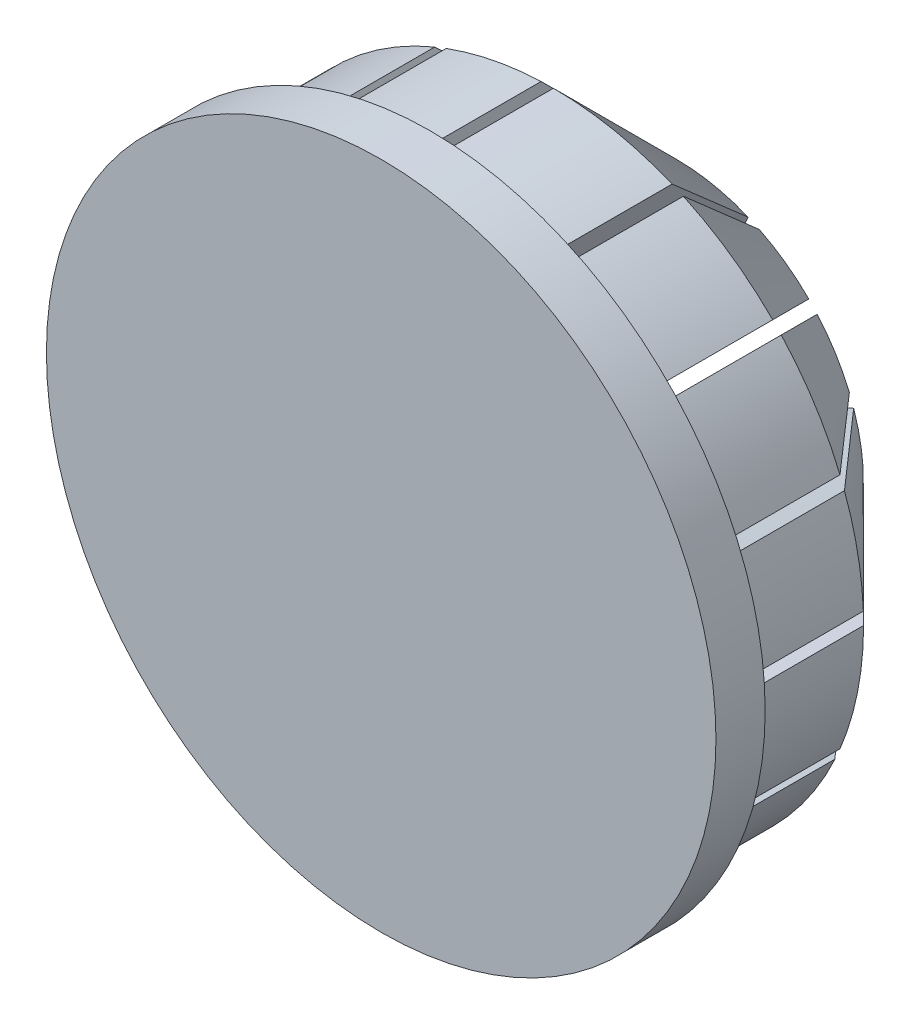
from build123d import *

# Parameters (mm, degrees)
SKETCH1_R            = 40
BOSS_EXTRUDE10_DEPTH = 2
BOSS_EXTRUDE12_START = -2
SKETCH4_R            = 37
BOSS_EXTRUDE12_DEPTH = 2
BOSS_EXTRUDE14_DEPTH = 20
BOSS_EXTRUDE15_DEPTH = 15
BOSS_EXTRUDE16_DEPTH = 10
CHAMFER6_SIZE        = 5
CHAMFER7_SIZE        = 5
CHAMFER8_SIZE        = 5
CHAMFER9_SIZE        = 1
SKETCH5_R            = 42.605372115
SKETCH5_R_2          = 13.605372115
CUT_EXTRUDE1_DEPTH   = 31


with BuildPart() as part:
    # Sketch1 → Boss-Extrude10 (new body)
    with BuildSketch(Plane.XY):
        Circle(SKETCH1_R)
        with BuildLine():
            ThreePointArc((-0.5, 36.996621467), (-0.250005707, 36.999155357), (0, 37))
            ThreePointArc((0, 37), (7.218341915, 36.289055375), (14.159286998, 34.183542703))
            ThreePointArc((14.159286998, 34.183542703), (14.389938923, 34.087089313), (14.619933855, 33.98907963))
            ThreePointArc((14.619933855, 33.98907963), (20.763501512, 30.624777631), (26.162950904, 26.162950904))
            ThreePointArc((26.162950904, 26.162950904), (26.339134382, 25.98557292), (26.514115311, 25.80700853))
            ThreePointArc((26.514115311, 25.80700853), (30.902569089, 20.347757215), (34.183542703, 14.159286998))
            ThreePointArc((34.183542703, 14.159286998), (34.278435397, 13.927988611), (34.371763062, 13.696054323))
            ThreePointArc((34.371763062, 13.696054323), (36.289055375, 7.218341915), (36.996621467, 0.5))
            ThreePointArc((36.996621467, 0.5), (36.999155357, 0.250005707), (37, 0))
            ThreePointArc((37, 0), (36.289055375, -7.218341915), (34.183542703, -14.159286998))
            ThreePointArc((34.183542703, -14.159286998), (34.087089313, -14.389938923), (33.98907963, -14.619933855))
            ThreePointArc((33.98907963, -14.619933855), (30.624777631, -20.763501512), (26.162950904, -26.162950904))
            ThreePointArc((26.162950904, -26.162950904), (25.98557292, -26.339134382), (25.80700853, -26.514115311))
            ThreePointArc((25.80700853, -26.514115311), (20.347757215, -30.902569089), (14.159286998, -34.183542703))
            ThreePointArc((14.159286998, -34.183542703), (13.927988611, -34.278435397), (13.696054323, -34.371763062))
            ThreePointArc((13.696054323, -34.371763062), (6.972975215, -36.337000656), (0, -37))
            ThreePointArc((0, -37), (-0.250005707, -36.999155357), (-0.5, -36.996621467))
            ThreePointArc((-0.5, -36.996621467), (-7.463379051, -36.239453268), (-14.159286998, -34.183542703))
            ThreePointArc((-14.159286998, -34.183542703), (-14.389938923, -34.087089313), (-14.619933855, -33.98907963))
            ThreePointArc((-14.619933855, -33.98907963), (-20.763501512, -30.624777631), (-26.162950904, -26.162950904))
            ThreePointArc((-26.162950904, -26.162950904), (-26.339134382, -25.98557292), (-26.514115311, -25.80700853))
            ThreePointArc((-26.514115311, -25.80700853), (-30.902569089, -20.347757215), (-34.183542703, -14.159286998))
            ThreePointArc((-34.183542703, -14.159286998), (-34.278435397, -13.927988611), (-34.371763062, -13.696054323))
            ThreePointArc((-34.371763062, -13.696054323), (-36.337000656, -6.972975215), (-37, 0))
            ThreePointArc((-37, 0), (-36.999155357, 0.250005707), (-36.996621467, 0.5))
            ThreePointArc((-36.996621467, 0.5), (-36.239453268, 7.463379051), (-34.183542703, 14.159286998))
            ThreePointArc((-34.183542703, 14.159286998), (-34.087089313, 14.389938923), (-33.98907963, 14.619933855))
            ThreePointArc((-33.98907963, 14.619933855), (-30.624777631, 20.763501512), (-26.162950904, 26.162950904))
            ThreePointArc((-26.162950904, 26.162950904), (-25.98557292, 26.339134382), (-25.80700853, 26.514115311))
            ThreePointArc((-25.80700853, 26.514115311), (-20.347757215, 30.902569089), (-14.159286998, 34.183542703))
            ThreePointArc((-14.159286998, 34.183542703), (-13.927988611, 34.278435397), (-13.696054323, 34.371763062))
            ThreePointArc((-13.696054323, 34.371763062), (-7.218341915, 36.289055375), (-0.5, 36.996621467))
        make_face(mode=Mode.SUBTRACT)
    extrude(amount=BOSS_EXTRUDE10_DEPTH)

    # Sketch4 → Boss-Extrude12 (add)
    with BuildSketch(Plane.XY.offset(2).offset(BOSS_EXTRUDE12_START)):
        Circle(SKETCH4_R)
    extrude(amount=BOSS_EXTRUDE12_DEPTH)

    # Sketch1<20> → Boss-Extrude14 (add)
    with BuildSketch(Plane.XY):
        with BuildLine():
            ThreePointArc((14.159286998, 34.183542703), (7.218341915, 36.289055375), (0, 37))
            Line((0, 37), (0, 29.036974883))
            ThreePointArc((0, 29.036974883), (5.66483278, 28.479037552), (11.111969214, 26.82666678))
            Line((11.111969214, 26.82666678), (14.159286998, 34.183542703))
        make_face()
        with BuildLine():
            Line((-0.5, 29.032669707), (-0.5, 36.996621467))
            ThreePointArc((-0.5, 36.996621467), (-7.218341915, 36.289055375), (-13.696054323, 34.371763062))
            Line((-13.696054323, 34.371763062), (-10.648381928, 27.014031033))
            ThreePointArc((-10.648381928, 27.014031033), (-5.66483278, 28.479037552), (-0.5, 29.032669707))
        make_face()
        with BuildLine():
            ThreePointArc((26.162950904, 26.162950904), (20.763501512, 30.624777631), (14.619933855, 33.98907963))
            Line((14.619933855, 33.98907963), (11.572261461, 26.631347601))
            ThreePointArc((11.572261461, 26.631347601), (16.339356042, 24.003569619), (20.532241845, 20.532241845))
            Line((20.532241845, 20.532241845), (26.162950904, 26.162950904))
        make_face()
        with BuildLine():
            Line((-11.111969214, 26.82666678), (-14.159286998, 34.183542703))
            ThreePointArc((-14.159286998, 34.183542703), (-20.347757215, 30.902569089), (-25.80700853, 26.514115311))
            Line((-25.80700853, 26.514115311), (-20.175644235, 20.882751017))
            ThreePointArc((-20.175644235, 20.882751017), (-15.923605825, 24.281365033), (-11.111969214, 26.82666678))
        make_face()
        with BuildLine():
            ThreePointArc((34.183542703, 14.159286998), (30.902569089, 20.347757215), (26.514115311, 25.80700853))
            Line((26.514115311, 25.80700853), (20.882751017, 20.175644235))
            ThreePointArc((20.882751017, 20.175644235), (24.281365033, 15.923605825), (26.82666678, 11.111969214))
            Line((26.82666678, 11.111969214), (34.183542703, 14.159286998))
        make_face()
        with BuildLine():
            Line((-20.532241845, 20.532241845), (-26.162950904, 26.162950904))
            ThreePointArc((-26.162950904, 26.162950904), (-30.624777631, 20.763501512), (-33.98907963, 14.619933855))
            Line((-33.98907963, 14.619933855), (-26.631347601, 11.572261461))
            ThreePointArc((-26.631347601, 11.572261461), (-24.003569619, 16.339356042), (-20.532241845, 20.532241845))
        make_face()
        with BuildLine():
            ThreePointArc((36.996621467, 0.5), (36.289055375, 7.218341915), (34.371763062, 13.696054323))
            Line((34.371763062, 13.696054323), (27.014031033, 10.648381928))
            ThreePointArc((27.014031033, 10.648381928), (28.479037552, 5.66483278), (29.032669707, 0.5))
            Line((29.032669707, 0.5), (36.996621467, 0.5))
        make_face()
        with BuildLine():
            Line((-26.82666678, 11.111969214), (-34.183542703, 14.159286998))
            ThreePointArc((-34.183542703, 14.159286998), (-36.239453268, 7.463379051), (-36.996621467, 0.5))
            Line((-36.996621467, 0.5), (-29.032669707, 0.5))
            ThreePointArc((-29.032669707, 0.5), (-28.429207531, 5.909828211), (-26.82666678, 11.111969214))
        make_face()
        with BuildLine():
            ThreePointArc((34.183542703, -14.159286998), (36.289055375, -7.218341915), (37, 0))
            Line((37, 0), (29.036974883, 0))
            ThreePointArc((29.036974883, 0), (28.479037552, -5.66483278), (26.82666678, -11.111969214))
            Line((26.82666678, -11.111969214), (34.183542703, -14.159286998))
        make_face()
        with BuildLine():
            Line((-29.036974883, 0), (-37, 0))
            ThreePointArc((-37, 0), (-36.337000656, -6.972975215), (-34.371763062, -13.696054323))
            Line((-34.371763062, -13.696054323), (-27.014031033, -10.648381928))
            ThreePointArc((-27.014031033, -10.648381928), (-28.526756308, -5.419417393), (-29.036974883, 0))
        make_face()
        with BuildLine():
            ThreePointArc((26.162950904, -26.162950904), (30.624777631, -20.763501512), (33.98907963, -14.619933855))
            Line((33.98907963, -14.619933855), (26.631347601, -11.572261461))
            ThreePointArc((26.631347601, -11.572261461), (24.003569619, -16.339356042), (20.532241845, -20.532241845))
            Line((20.532241845, -20.532241845), (26.162950904, -26.162950904))
        make_face()
        with BuildLine():
            Line((-26.82666678, -11.111969214), (-34.183542703, -14.159286998))
            ThreePointArc((-34.183542703, -14.159286998), (-30.902569089, -20.347757215), (-26.514115311, -25.80700853))
            Line((-26.514115311, -25.80700853), (-20.882751017, -20.175644235))
            ThreePointArc((-20.882751017, -20.175644235), (-24.281365033, -15.923605825), (-26.82666678, -11.111969214))
        make_face()
        with BuildLine():
            ThreePointArc((14.159286998, -34.183542703), (20.347757215, -30.902569089), (25.80700853, -26.514115311))
            Line((25.80700853, -26.514115311), (20.175644235, -20.882751017))
            ThreePointArc((20.175644235, -20.882751017), (15.923605825, -24.281365033), (11.111969214, -26.82666678))
            Line((11.111969214, -26.82666678), (14.159286998, -34.183542703))
        make_face()
        with BuildLine():
            Line((-20.532241845, -20.532241845), (-26.162950904, -26.162950904))
            ThreePointArc((-26.162950904, -26.162950904), (-20.763501512, -30.624777631), (-14.619933855, -33.98907963))
            Line((-14.619933855, -33.98907963), (-11.572261461, -26.631347601))
            ThreePointArc((-11.572261461, -26.631347601), (-16.339356042, -24.003569619), (-20.532241845, -20.532241845))
        make_face()
        with BuildLine():
            ThreePointArc((0, -37), (6.972975215, -36.337000656), (13.696054323, -34.371763062))
            Line((13.696054323, -34.371763062), (10.648381928, -27.014031033))
            ThreePointArc((10.648381928, -27.014031033), (5.419417393, -28.526756308), (0, -29.036974883))
            Line((0, -29.036974883), (0, -37))
        make_face()
        with BuildLine():
            Line((-11.111969214, -26.82666678), (-14.159286998, -34.183542703))
            ThreePointArc((-14.159286998, -34.183542703), (-7.463379051, -36.239453268), (-0.5, -36.996621467))
            Line((-0.5, -36.996621467), (-0.5, -29.032669707))
            ThreePointArc((-0.5, -29.032669707), (-5.909828211, -28.429207531), (-11.111969214, -26.82666678))
        make_face()
    extrude(amount=-BOSS_EXTRUDE14_DEPTH)

    # Sketch1<21> → Boss-Extrude15 (add)
    with BuildSketch(Plane.XY):
        with BuildLine():
            ThreePointArc((9.963918917, 24.055028183), (5.079561814, 25.536681711), (0, 26.036974883))
            Line((0, 26.036974883), (0, 13.605372115))
            ThreePointArc((0, 13.605372115), (2.654276427, 13.343948705), (5.2065505, 12.56972483))
            Line((5.2065505, 12.56972483), (9.963918917, 24.055028183))
        make_face()
        with BuildLine():
            Line((-0.5, 13.596181464), (-0.5, 26.032173575))
            ThreePointArc((-0.5, 26.032173575), (-5.079561814, 25.536681711), (-9.500141769, 24.241934069))
            Line((-9.500141769, 24.241934069), (-4.741093623, 12.752575491))
            ThreePointArc((-4.741093623, 12.752575491), (-2.654276427, 13.343948705), (-0.5, 13.596181464))
        make_face()
        with BuildLine():
            ThreePointArc((18.410921501, 18.410921501), (14.672578308, 21.509056391), (10.424021302, 23.859250637))
            Line((10.424021302, 23.859250637), (5.664973156, 12.369892059))
            ThreePointArc((5.664973156, 12.369892059), (7.765365652, 11.17162686), (9.620450883, 9.620450883))
            Line((9.620450883, 9.620450883), (18.410921501, 18.410921501))
        make_face()
        with BuildLine():
            Line((-5.2065505, 12.56972483), (-9.963918917, 24.055028183))
            ThreePointArc((-9.963918917, 24.055028183), (-14.256824335, 21.786854315), (-18.053973073, 18.761079855))
            Line((-18.053973073, 18.761079855), (-9.260398721, 9.967505502))
            ThreePointArc((-9.260398721, 9.967505502), (-7.349560619, 11.4494589), (-5.2065505, 12.56972483))
        make_face()
        with BuildLine():
            ThreePointArc((24.055028183, 9.963918917), (21.786854315, 14.256824335), (18.761079855, 18.053973073))
            Line((18.761079855, 18.053973073), (9.967505502, 9.260398721))
            ThreePointArc((9.967505502, 9.260398721), (11.4494589, 7.349560619), (12.56972483, 5.2065505))
            Line((12.56972483, 5.2065505), (24.055028183, 9.963918917))
        make_face()
        with BuildLine():
            Line((-9.620450883, 9.620450883), (-18.410921501, 18.410921501))
            ThreePointArc((-18.410921501, 18.410921501), (-21.509056391, 14.672578308), (-23.859250637, 10.424021302))
            Line((-23.859250637, 10.424021302), (-12.369892059, 5.664973156))
            ThreePointArc((-12.369892059, 5.664973156), (-11.17162686, 7.765365652), (-9.620450883, 9.620450883))
        make_face()
        with BuildLine():
            ThreePointArc((26.032173575, 0.5), (25.536681711, 5.079561814), (24.241934069, 9.500141769))
            Line((24.241934069, 9.500141769), (12.752575491, 4.741093623))
            ThreePointArc((12.752575491, 4.741093623), (13.343948705, 2.654276427), (13.596181464, 0.5))
            Line((13.596181464, 0.5), (26.032173575, 0.5))
        make_face()
        with BuildLine():
            Line((-12.56972483, 5.2065505), (-24.055028183, 9.963918917))
            ThreePointArc((-24.055028183, 9.963918917), (-25.486729592, 5.324535261), (-26.032173575, 0.5))
            Line((-26.032173575, 0.5), (-13.596181464, 0.5))
            ThreePointArc((-13.596181464, 0.5), (-13.292914182, 2.899065877), (-12.56972483, 5.2065505))
        make_face()
        with BuildLine():
            ThreePointArc((24.055028183, -9.963918917), (25.536681711, -5.079561814), (26.036974883, 0))
            Line((26.036974883, 0), (13.605372115, 0))
            ThreePointArc((13.605372115, 0), (13.343948705, -2.654276427), (12.56972483, -5.2065505))
            Line((12.56972483, -5.2065505), (24.055028183, -9.963918917))
        make_face()
        with BuildLine():
            Line((-13.605372115, 0), (-26.036974883, 0))
            ThreePointArc((-26.036974883, 0), (-25.58427925, -4.834120012), (-24.241934069, -9.500141769))
            Line((-24.241934069, -9.500141769), (-12.752575491, -4.741093623))
            ThreePointArc((-12.752575491, -4.741093623), (-13.39047582, -2.408590398), (-13.605372115, 0))
        make_face()
        with BuildLine():
            ThreePointArc((18.410921501, -18.410921501), (21.509056391, -14.672578308), (23.859250637, -10.424021302))
            Line((23.859250637, -10.424021302), (12.369892059, -5.664973156))
            ThreePointArc((12.369892059, -5.664973156), (11.17162686, -7.765365652), (9.620450883, -9.620450883))
            Line((9.620450883, -9.620450883), (18.410921501, -18.410921501))
        make_face()
        with BuildLine():
            Line((-12.56972483, -5.2065505), (-24.055028183, -9.963918917))
            ThreePointArc((-24.055028183, -9.963918917), (-21.786854315, -14.256824335), (-18.761079855, -18.053973073))
            Line((-18.761079855, -18.053973073), (-9.967505502, -9.260398721))
            ThreePointArc((-9.967505502, -9.260398721), (-11.4494589, -7.349560619), (-12.56972483, -5.2065505))
        make_face()
        with BuildLine():
            ThreePointArc((9.963918917, -24.055028183), (14.256824335, -21.786854315), (18.053973073, -18.761079855))
            Line((18.053973073, -18.761079855), (9.260398721, -9.967505502))
            ThreePointArc((9.260398721, -9.967505502), (7.349560619, -11.4494589), (5.2065505, -12.56972483))
            Line((5.2065505, -12.56972483), (9.963918917, -24.055028183))
        make_face()
        with BuildLine():
            Line((-9.620450883, -9.620450883), (-18.410921501, -18.410921501))
            ThreePointArc((-18.410921501, -18.410921501), (-14.672578308, -21.509056391), (-10.424021302, -23.859250637))
            Line((-10.424021302, -23.859250637), (-5.664973156, -12.369892059))
            ThreePointArc((-5.664973156, -12.369892059), (-7.765365652, -11.17162686), (-9.620450883, -9.620450883))
        make_face()
        with BuildLine():
            ThreePointArc((4.741093623, -12.752575491), (2.408590398, -13.39047582), (0, -13.605372115))
            Line((0, -13.605372115), (0, -26.036974883))
            ThreePointArc((0, -26.036974883), (4.834120012, -25.58427925), (9.500141769, -24.241934069))
            Line((9.500141769, -24.241934069), (4.741093623, -12.752575491))
        make_face()
        with BuildLine():
            Line((-0.5, -26.032173575), (-0.5, -13.596181464))
            ThreePointArc((-0.5, -13.596181464), (-2.899065877, -13.292914182), (-5.2065505, -12.56972483))
            Line((-5.2065505, -12.56972483), (-9.963918917, -24.055028183))
            ThreePointArc((-9.963918917, -24.055028183), (-5.324535261, -25.486729592), (-0.5, -26.032173575))
        make_face()
    extrude(amount=-BOSS_EXTRUDE15_DEPTH)

    # Sketch1<22> → Boss-Extrude16 (add)
    with BuildSketch(Plane.XY):
        with BuildLine():
            ThreePointArc((4.823867067, 11.645845297), (2.459186105, 12.363163425), (0, 12.605372115))
            Line((0, 12.605372115), (0, 3.781256431))
            ThreePointArc((0, 3.781256431), (0.737686535, 3.708600649), (1.44702419, 3.493425424))
            Line((1.44702419, 3.493425424), (4.823867067, 11.645845297))
        make_face()
        with BuildLine():
            Line((-0.5, 3.748052854), (-0.5, 12.595451805))
            ThreePointArc((-0.5, 12.595451805), (-2.459186105, 12.363163425), (-4.358130963, 11.828021841))
            Line((-4.358130963, 11.828021841), (-0.972377965, 3.654091035))
            ThreePointArc((-0.972377965, 3.654091035), (-0.737686535, 3.708600649), (-0.5, 3.748052854))
        make_face()
        with BuildLine():
            ThreePointArc((8.913344102, 8.913344102), (7.209699843, 10.340001661), (5.282010495, 11.445338409))
            Line((5.282010495, 11.445338409), (1.896257497, 3.271407603))
            ThreePointArc((1.896257497, 3.271407603), (2.304461951, 2.997891812), (2.673752064, 2.673752064))
            Line((2.673752064, 2.673752064), (8.913344102, 8.913344102))
        make_face()
        with BuildLine():
            Line((-1.44702419, 3.493425424), (-4.823867067, 11.645845297))
            ThreePointArc((-4.823867067, 11.645845297), (-6.793883218, 10.617841447), (-8.552775993, 9.259882774))
            Line((-8.552775993, 9.259882774), (-2.296720199, 3.00382698))
            ThreePointArc((-2.296720199, 3.00382698), (-1.887811476, 3.276288758), (-1.44702419, 3.493425424))
        make_face()
        with BuildLine():
            ThreePointArc((11.645845297, 4.823867067), (10.617841447, 6.793883218), (9.259882774, 8.552775993))
            Line((9.259882774, 8.552775993), (3.00382698, 2.296720199))
            ThreePointArc((3.00382698, 2.296720199), (3.276288758, 1.887811476), (3.493425424, 1.44702419))
            Line((3.493425424, 1.44702419), (11.645845297, 4.823867067))
        make_face()
        with BuildLine():
            Line((-2.673752064, 2.673752064), (-8.913344102, 8.913344102))
            ThreePointArc((-8.913344102, 8.913344102), (-10.340001661, 7.209699843), (-11.445338409, 5.282010495))
            Line((-11.445338409, 5.282010495), (-3.271407603, 1.896257497))
            ThreePointArc((-3.271407603, 1.896257497), (-2.997891812, 2.304461951), (-2.673752064, 2.673752064))
        make_face()
        with BuildLine():
            ThreePointArc((12.595451805, 0.5), (12.363163425, 2.459186105), (11.828021841, 4.358130963))
            Line((11.828021841, 4.358130963), (3.654091035, 0.972377965))
            ThreePointArc((3.654091035, 0.972377965), (3.708600649, 0.737686535), (3.748052854, 0.5))
            Line((3.748052854, 0.5), (12.595451805, 0.5))
        make_face()
        with BuildLine():
            Line((-3.493425424, 1.44702419), (-11.645845297, 4.823867067))
            ThreePointArc((-11.645845297, 4.823867067), (-12.311948583, 2.703946795), (-12.595451805, 0.5))
            Line((-12.595451805, 0.5), (-3.748052854, 0.5))
            ThreePointArc((-3.748052854, 0.5), (-3.651570295, 0.981801701), (-3.493425424, 1.44702419))
        make_face()
        with BuildLine():
            ThreePointArc((11.645845297, -4.823867067), (12.363163425, -2.459186105), (12.605372115, 0))
            Line((12.605372115, 0), (3.781256431, 0))
            ThreePointArc((3.781256431, 0), (3.708600649, -0.737686535), (3.493425424, -1.44702419))
            Line((3.493425424, -1.44702419), (11.645845297, -4.823867067))
        make_face()
        with BuildLine():
            ThreePointArc((-3.654091035, -0.972377965), (-3.749330302, -0.490328957), (-3.781256431, 0))
            Line((-3.781256431, 0), (-12.605372115, 0))
            ThreePointArc((-12.605372115, 0), (-12.409512941, -2.213457642), (-11.828021841, -4.358130963))
            Line((-11.828021841, -4.358130963), (-3.654091035, -0.972377965))
        make_face()
        with BuildLine():
            ThreePointArc((0.972377965, -3.654091035), (0.490328957, -3.749330302), (0, -3.781256431))
            Line((0, -3.781256431), (0, -12.605372115))
            ThreePointArc((0, -12.605372115), (2.213457642, -12.409512941), (4.358130963, -11.828021841))
            Line((4.358130963, -11.828021841), (0.972377965, -3.654091035))
        make_face()
        with BuildLine():
            ThreePointArc((2.296720199, -3.00382698), (1.887811476, -3.276288758), (1.44702419, -3.493425424))
            Line((1.44702419, -3.493425424), (4.823867067, -11.645845297))
            ThreePointArc((4.823867067, -11.645845297), (6.793883218, -10.617841447), (8.552775993, -9.259882774))
            Line((8.552775993, -9.259882774), (2.296720199, -3.00382698))
        make_face()
        with BuildLine():
            ThreePointArc((3.271407603, -1.896257497), (2.997891812, -2.304461951), (2.673752064, -2.673752064))
            Line((2.673752064, -2.673752064), (8.913344102, -8.913344102))
            ThreePointArc((8.913344102, -8.913344102), (10.340001661, -7.209699843), (11.445338409, -5.282010495))
            Line((11.445338409, -5.282010495), (3.271407603, -1.896257497))
        make_face()
        with BuildLine():
            Line((-0.5, -12.595451805), (-0.5, -3.748052854))
            ThreePointArc((-0.5, -3.748052854), (-0.981801701, -3.651570295), (-1.44702419, -3.493425424))
            Line((-1.44702419, -3.493425424), (-4.823867067, -11.645845297))
            ThreePointArc((-4.823867067, -11.645845297), (-2.703946795, -12.311948583), (-0.5, -12.595451805))
        make_face()
        with BuildLine():
            ThreePointArc((-3.00382698, -2.296720199), (-3.276288758, -1.887811476), (-3.493425424, -1.44702419))
            Line((-3.493425424, -1.44702419), (-11.645845297, -4.823867067))
            ThreePointArc((-11.645845297, -4.823867067), (-10.617841447, -6.793883218), (-9.259882774, -8.552775993))
            Line((-9.259882774, -8.552775993), (-3.00382698, -2.296720199))
        make_face()
        with BuildLine():
            ThreePointArc((-1.896257497, -3.271407603), (-2.304461951, -2.997891812), (-2.673752064, -2.673752064))
            Line((-2.673752064, -2.673752064), (-8.913344102, -8.913344102))
            ThreePointArc((-8.913344102, -8.913344102), (-7.209699843, -10.340001661), (-5.282010495, -11.445338409))
            Line((-5.282010495, -11.445338409), (-1.896257497, -3.271407603))
        make_face()
    extrude(amount=-BOSS_EXTRUDE16_DEPTH)

    # Chamfer6
    chamfer6_edges = [part.edges().sort_by_distance(p)[0] for p in [
        (-36.239453268, 7.463379051, -20),
        (-36.337000656, -6.972975215, -20),
        (-30.902569089, -20.347757215, -20),
        (-20.763501512, -30.624777631, -20),
        (-7.463379051, -36.239453268, -20),
        (6.972975215, -36.337000656, -20),
        (20.347757215, -30.902569089, -20),
        (30.624777631, -20.763501512, -20),
        (36.289055375, -7.218341915, -20),
        (36.289055375, 7.218341915, -20),
        (30.902569089, 20.347757215, -20),
        (20.763501512, 30.624777631, -20),
        (7.218341915, 36.289055375, -20),
        (-7.218341915, 36.289055375, -20),
        (-20.347757215, 30.902569089, -20),
        (-30.624777631, 20.763501512, -20),
    ]]
    chamfer(chamfer6_edges, length=CHAMFER6_SIZE)

    # Chamfer7
    chamfer7_edges = [part.edges().sort_by_distance(p)[0] for p in [
        (-5.079561814, 25.536681711, -15),
        (-14.256824335, 21.786854315, -15),
        (-21.509056391, 14.672578308, -15),
        (-25.486729592, 5.324535261, -15),
        (-25.58427925, -4.834120012, -15),
        (-21.786854315, -14.256824335, -15),
        (14.672578308, 21.509056391, -15),
        (21.786854315, 14.256824335, -15),
        (25.536681711, 5.079561814, -15),
        (25.536681711, -5.079561814, -15),
        (21.509056391, -14.672578308, -15),
        (14.256824335, -21.786854315, -15),
        (4.834120012, -25.58427925, -15),
        (-5.324535261, -25.486729592, -15),
        (-14.672578308, -21.509056391, -15),
        (-7.765365652, -11.17162686, -15),
        (-11.4494589, -7.349560619, -15),
        (-13.39047582, -2.408590398, -15),
        (-13.292914182, 2.899065877, -15),
        (-11.17162686, 7.765365652, -15),
        (-7.349560619, 11.4494589, -15),
        (-2.654276427, 13.343948705, -15),
        (-2.899065877, -13.292914182, -15),
        (2.408590398, -13.39047582, -15),
        (7.349560619, -11.4494589, -15),
        (11.17162686, -7.765365652, -15),
        (13.343948705, -2.654276427, -15),
        (13.343948705, 2.654276427, -15),
        (11.4494589, 7.349560619, -15),
        (7.765365652, 11.17162686, -15),
        (2.654276427, 13.343948705, -15),
        (5.079561814, 25.536681711, -15),
    ]]
    chamfer(chamfer7_edges, length=CHAMFER7_SIZE)

    # Chamfer8
    chamfer8_edges = [part.edges().sort_by_distance(p)[0] for p in [
        (7.209699843, 10.340001661, -10),
        (10.617841447, 6.793883218, -10),
        (12.363163425, 2.459186105, -10),
        (12.363163425, -2.459186105, -10),
        (10.340001661, -7.209699843, -10),
        (6.793883218, -10.617841447, -10),
        (2.213457642, -12.409512941, -10),
        (-2.703946795, -12.311948583, -10),
        (-7.209699843, -10.340001661, -10),
        (-10.617841447, -6.793883218, -10),
        (-12.409512941, -2.213457642, -10),
        (-12.311948583, 2.703946795, -10),
        (-10.340001661, 7.209699843, -10),
        (-6.793883218, 10.617841447, -10),
        (-2.459186105, 12.363163425, -10),
        (2.459186105, 12.363163425, -10),
    ]]
    chamfer(chamfer8_edges, length=CHAMFER8_SIZE)

    # Chamfer9
    chamfer9_edges = [part.edges().sort_by_distance(p)[0] for p in [
        (-16.339356042, -24.003569619, -20),
        (-24.281365033, -15.923605825, -20),
        (-28.526756308, -5.419417393, -20),
        (-28.429207531, 5.909828211, -20),
        (-24.003569619, 16.339356042, -20),
        (-15.923605825, 24.281365033, -20),
        (5.66483278, 28.479037552, -20),
        (-5.66483278, 28.479037552, -20),
        (16.339356042, 24.003569619, -20),
        (24.281365033, 15.923605825, -20),
        (28.479037552, 5.66483278, -20),
        (28.479037552, -5.66483278, -20),
        (24.003569619, -16.339356042, -20),
        (15.923605825, -24.281365033, -20),
        (5.419417393, -28.526756308, -20),
        (-5.909828211, -28.429207531, -20),
    ]]
    chamfer(chamfer9_edges, length=CHAMFER9_SIZE)

    # Sketch5 → Cut-Extrude1 (cut)
    with BuildSketch(Plane.XY.offset(2)):
        Circle(SKETCH5_R)
        Circle(SKETCH5_R_2, mode=Mode.SUBTRACT)
    extrude(amount=-CUT_EXTRUDE1_DEPTH, mode=Mode.SUBTRACT)


solid = part.part
